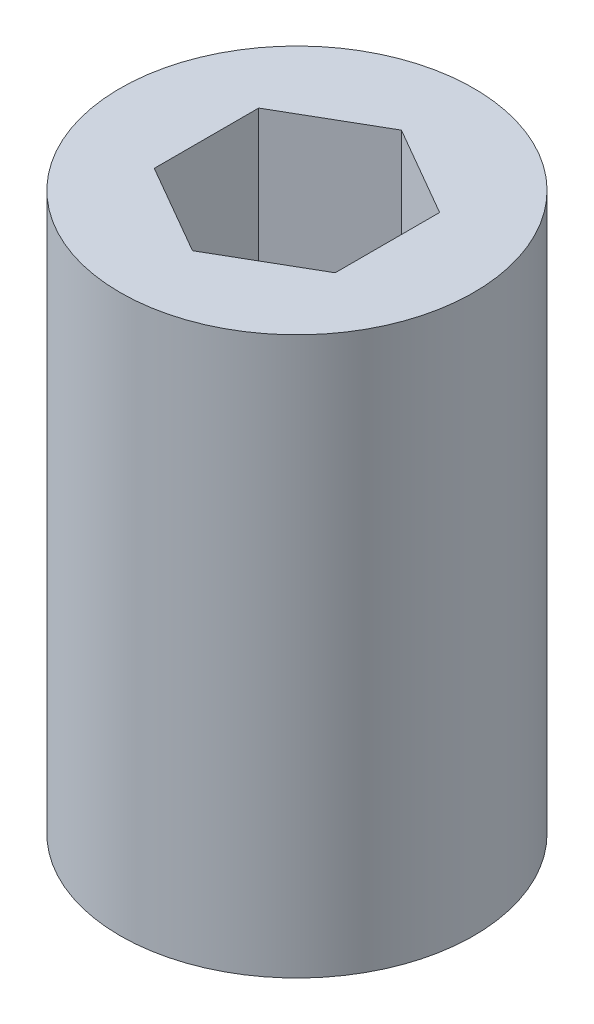
from build123d import *

# Parameters (mm, degrees)
SKETCH1_R           = 25.4
BOSS_EXTRUDE1_DEPTH = 80


with BuildPart() as part:
    # Sketch1 → Boss-Extrude1 (new body)
    with BuildSketch(Plane(origin=(0, 0, 0), x_dir=(1, 0, 0), z_dir=(0, 1, 0))):
        with Locations(Location((0, 0, 0), (0, 0, 270))):
            Circle(SKETCH1_R)
        Polygon((12.990381057, 7.5), (0, 15), (-12.990381057, 7.5), (-12.990381057, -7.5), (0, -15), (12.990381057, -7.5), align=None, mode=Mode.SUBTRACT)
    extrude(amount=-BOSS_EXTRUDE1_DEPTH)


solid = part.part
